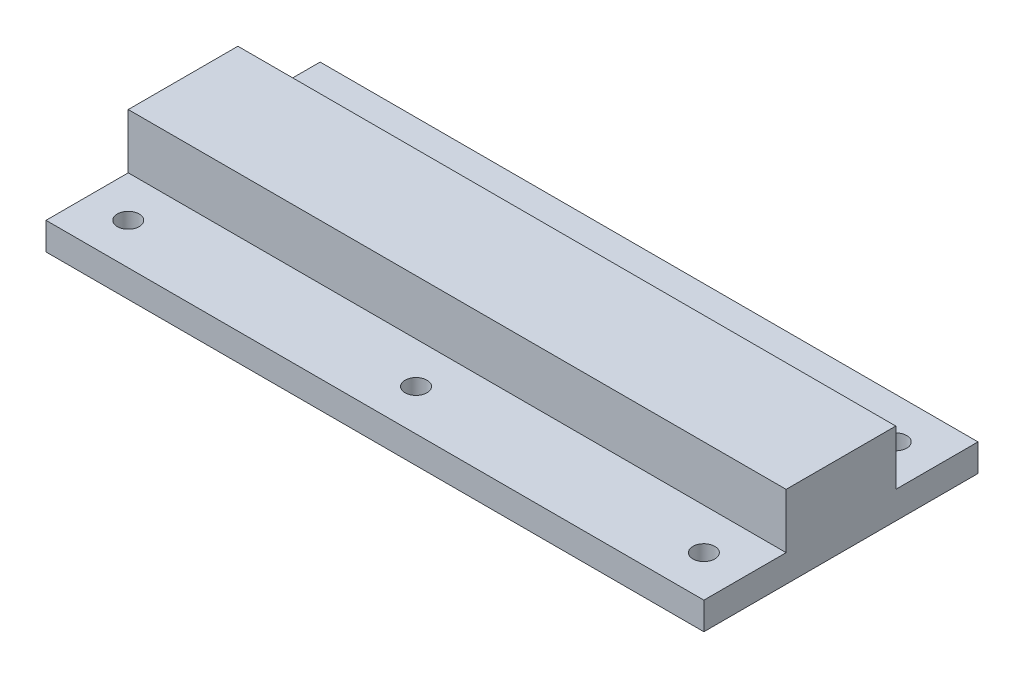
from build123d import *

# Parameters (mm, degrees)
SKETCH2_W                       = 120
SKETCH2_H                       = 50
BOSS_EXTRUDE1_DEPTH             = 15
SKIZZE7_R                       = 1.5
SCHNITT_LINEAR_AUSTRAGEN6_DEPTH = 10
SKIZZE10_W                      = 12.5
SKIZZE10_H                      = 1.5
ROTATION3_ANGLE                 = 180
SKIZZE11_W                      = 12.5
SKIZZE11_H                      = 1.5
ROTATION4_ANGLE                 = 180
SKIZZE12_R                      = 2
SCHNITT_LINEAR_AUSTRAGEN7_DEPTH = 83.233536557
SKIZZE13_W                      = 15
SKIZZE13_H                      = 10
SCHNITT_LINEAR_AUSTRAGEN8_DEPTH = 126.771499808


with BuildPart() as part:
    # Sketch2 → Boss-Extrude1 (new body)
    with BuildSketch(Plane(origin=(0, 0, 0), x_dir=(1, 0, 0), z_dir=(0, 1, 0))):
        with Locations((13.101876656, 9.54663752)):
            Rectangle(SKETCH2_W, SKETCH2_H)
    extrude(amount=BOSS_EXTRUDE1_DEPTH)

    # Skizze7 → Schnitt-Linear austragen6 (cut)
    with BuildSketch(Plane.ZY.offset(46.898123344)):
        with Locations((-9.54663752, 2.5)):
            Circle(SKIZZE7_R)
    extrude(amount=-SCHNITT_LINEAR_AUSTRAGEN6_DEPTH, mode=Mode.SUBTRACT)

    # Sketch3 → Schnitt-Rotation1 (revolve, cut)
    with BuildSketch(Plane(origin=(0, 0, 0), x_dir=(1, 0, 0), z_dir=(0, 1, 0))):
        Polygon((63.101876656, 9.54663752), (63.101876656, 17.04663752), (3.101876656, 17.04663752), (3.101876656, 19.54663752), (-36.898123344, 19.54663752), (-36.898123344, 9.54663752), align=None)
    revolve(axis=Axis((74.354835368, 0, -9.54663752), (-1, 0, 0)), mode=Mode.SUBTRACT)

    # Skizze10 → Rotation3 (revolve)
    with BuildSketch(Plane.XZ):
        with Locations((46.851876656, -16.29663752)):
            Rectangle(SKIZZE10_W, SKIZZE10_H)
    revolve(axis=Axis((85.744816074, 0, -9.54663752), (1, 0, 0)), revolution_arc=ROTATION3_ANGLE)

    # Skizze11 → Rotation4 (revolve)
    with BuildSketch(Plane.XZ):
        with Locations((21.851876656, -16.29663752)):
            Rectangle(SKIZZE11_W, SKIZZE11_H)
    revolve(axis=Axis((95.037830494, 0, -9.54663752), (1, 0, 0)), revolution_arc=ROTATION4_ANGLE)

    # Skizze12 → Schnitt-Linear austragen7 (cut, through all)
    with BuildSketch(Plane.XZ):
        with Locations(Location((-39.398123344, 7.95336248, 0), (0, 0, 270))):
            Circle(SKIZZE12_R)
        with Locations(Location((13.101876656, 7.95336248, 0), (0, 0, 270))):
            Circle(SKIZZE12_R)
        with Locations(Location((65.601876656, 7.95336248, 0), (0, 0, 270))):
            Circle(SKIZZE12_R)
    schnitt_linear_austragen7 = extrude(amount=-SCHNITT_LINEAR_AUSTRAGEN7_DEPTH, mode=Mode.SUBTRACT)

    # Spiegeln1: Schnitt-Linear austragen7 across plane
    add(schnitt_linear_austragen7.mirror(Plane.XY.offset(-9.54663752)), mode=Mode.SUBTRACT)

    # Skizze13 → Schnitt-Linear austragen8 (cut, through all)
    with BuildSketch(Plane.ZY.offset(46.898123344)):
        with Locations((7.95336248, 10)):
            Rectangle(SKIZZE13_W, SKIZZE13_H)
        with Locations((-27.04663752, 10)):
            Rectangle(SKIZZE13_W, SKIZZE13_H)
    extrude(amount=-SCHNITT_LINEAR_AUSTRAGEN8_DEPTH, mode=Mode.SUBTRACT)


solid = part.part
